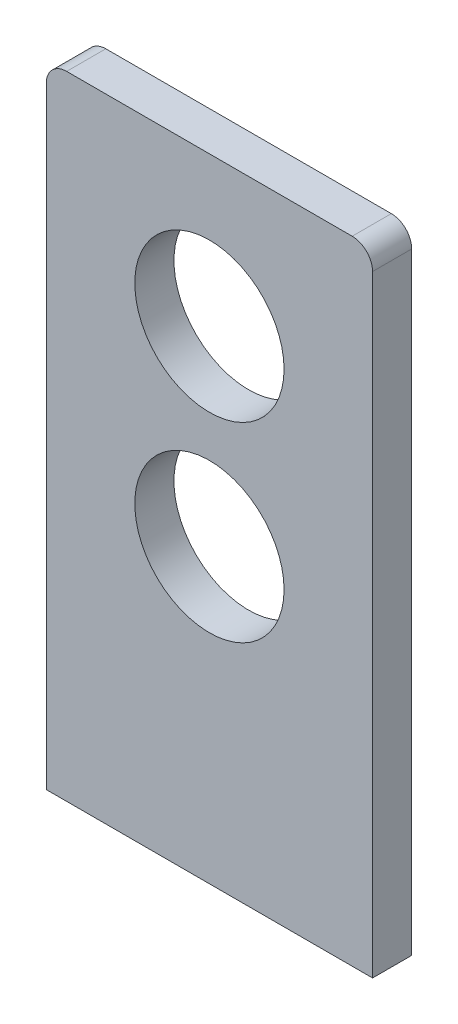
from build123d import *

# Parameters (mm, degrees)
SKETCH1_R           = 23.241
BOSS_EXTRUDE1_DEPTH = 12.192


with BuildPart() as part:
    # Sketch1 → Boss-Extrude1 (new body)
    with BuildSketch(Plane.XY):
        with BuildLine():
            Line((-44.45, 76.2), (44.45, 76.2))
            ThreePointArc((44.45, 76.2), (48.940128061, 74.340128061), (50.8, 69.85))
            Line((50.8, 69.85), (50.8, -69.85))
            Line((50.8, -69.85), (50.8, -120.65))
            Line((50.8, -120.65), (-50.8, -120.65))
            Line((-50.8, -120.65), (-50.8, -69.85))
            Line((-50.8, -69.85), (-50.8, 69.85))
            ThreePointArc((-50.8, 69.85), (-48.940128061, 74.340128061), (-44.45, 76.2))
        make_face()
        with Locations((0, 29.718)):
            Circle(SKETCH1_R, mode=Mode.SUBTRACT)
        with Locations((0, -29.718)):
            Circle(SKETCH1_R, mode=Mode.SUBTRACT)
    extrude(amount=-BOSS_EXTRUDE1_DEPTH)


solid = part.part
